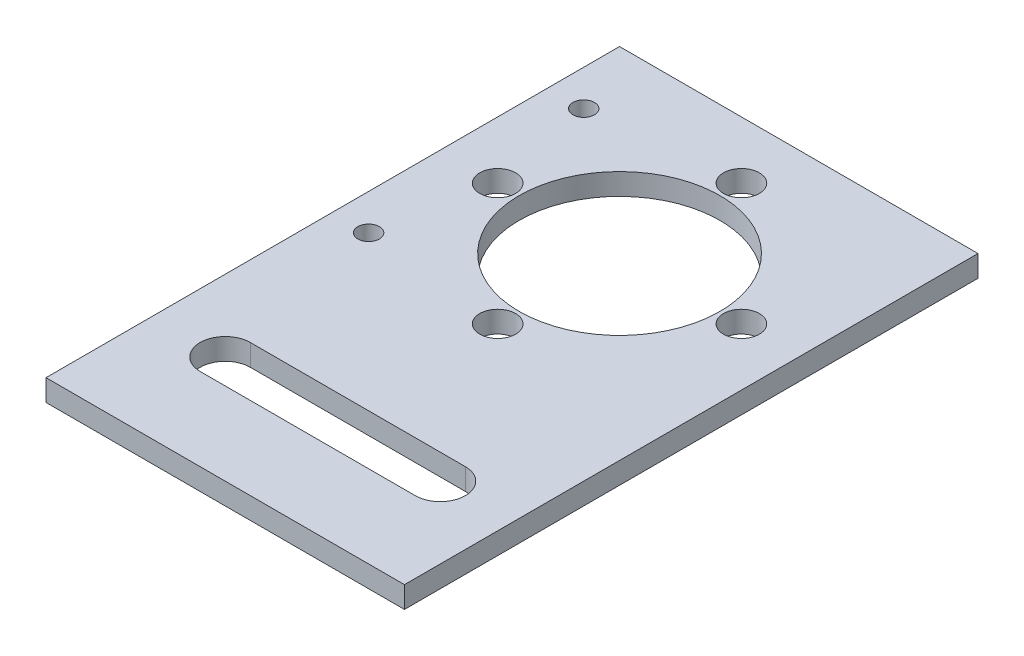
from build123d import *

# Parameters (mm, degrees)
SKETCH1_W           = 50
SKETCH1_H           = 80
SKETCH1_R           = 2.5
SKETCH1_R_2         = 14
BOSS_EXTRUDE1_DEPTH = 3
SKETCH2_R           = 1.5
CUT_EXTRUDE1_DEPTH  = 10


with BuildPart() as part:
    # Sketch1 → Boss-Extrude1 (new body)
    with BuildSketch(Plane(origin=(0, 0, 0), x_dir=(1, 0, 0), z_dir=(0, 1, 0))):
        Rectangle(SKETCH1_W, SKETCH1_H)
        with Locations(Location((0, 32, 0), (0, 0, 270))):
            Circle(SKETCH1_R, mode=Mode.SUBTRACT)
        with Locations(Location((17, 15, 0), (0, 0, 270))):
            Circle(SKETCH1_R, mode=Mode.SUBTRACT)
        with Locations(Location((0, -2, 0), (0, 0, 270))):
            Circle(SKETCH1_R, mode=Mode.SUBTRACT)
        with Locations(Location((-17, 15, 0), (0, 0, 270))):
            Circle(SKETCH1_R, mode=Mode.SUBTRACT)
        with Locations(Location((0, 15, 0), (0, 0, 270))):
            Circle(SKETCH1_R_2, mode=Mode.SUBTRACT)
        with BuildLine():
            Line((-15, -21.5), (15, -21.5))
            ThreePointArc((15, -21.5), (18.5, -25), (15, -28.5))
            Line((15, -28.5), (-15, -28.5))
            ThreePointArc((-15, -28.5), (-18.5, -25), (-15, -21.5))
        make_face(mode=Mode.SUBTRACT)
    extrude(amount=BOSS_EXTRUDE1_DEPTH)

    # Sketch2 → Cut-Extrude1 (cut)
    with BuildSketch(Plane(origin=(0, 3, 0), x_dir=(1, 0, 0), z_dir=(0, 1, 0))):
        with Locations(Location((-20, 30, 0), (0, 0, 270))):
            Circle(SKETCH2_R)
        with Locations(Location((-20, 0, 0), (0, 0, 270))):
            Circle(SKETCH2_R)
    extrude(amount=-CUT_EXTRUDE1_DEPTH, mode=Mode.SUBTRACT)


solid = part.part
